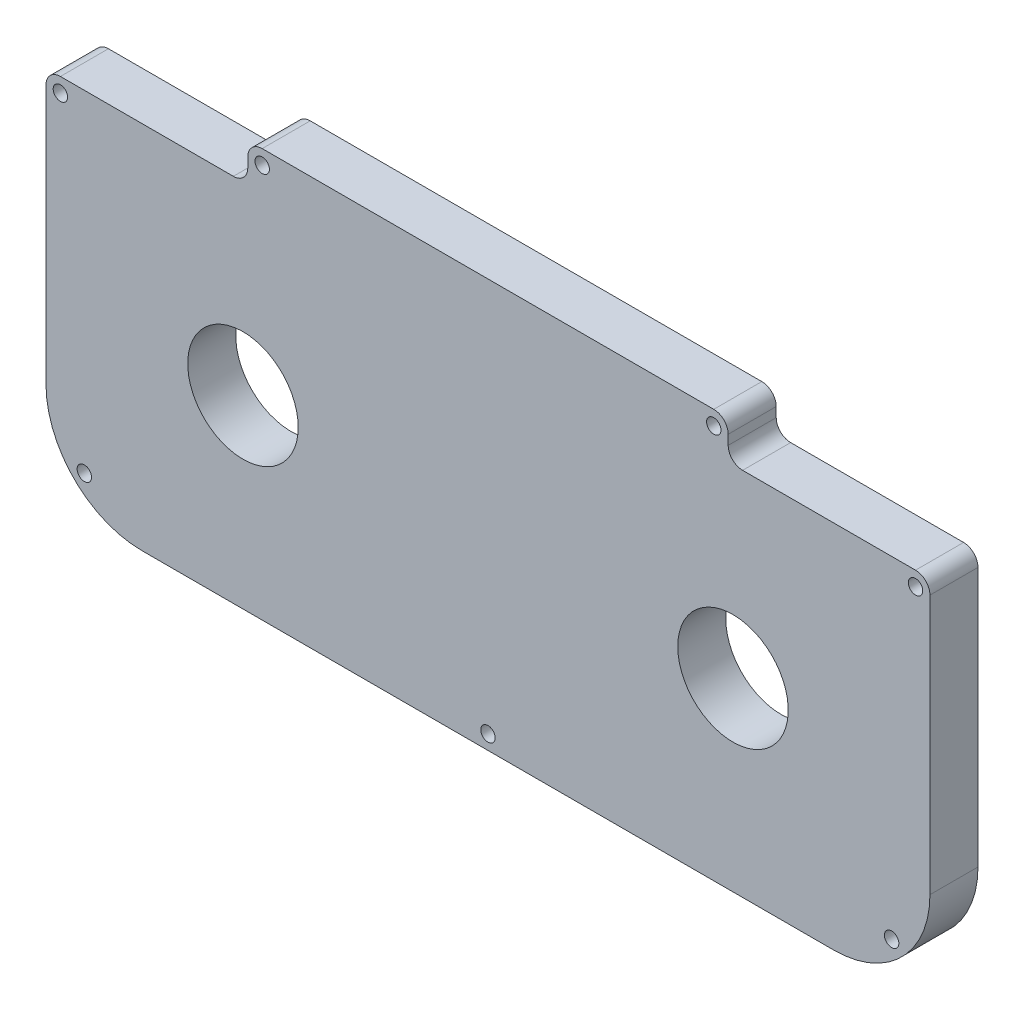
from build123d import *

# Parameters (mm, degrees)
SKETCH1_R           = 11.5
SKETCH1_R_2         = 1.5
BOSS_EXTRUDE1_DEPTH = 10


with BuildPart() as part:
    # Sketch1 → Boss-Extrude1 (new body)
    with BuildSketch(Plane.XY):
        with BuildLine():
            Line((50, 39.5), (50, 37.5))
            ThreePointArc((50, 37.5), (50.878679656, 35.378679656), (53, 34.5))
            Line((53, 34.5), (89, 34.5))
            ThreePointArc((89, 34.5), (91.121320344, 33.621320344), (92, 31.5))
            Line((92, 31.5), (92, -22.5))
            ThreePointArc((92, -22.5), (86.142135624, -36.642135624), (72, -42.5))
            Line((72, -42.5), (-72, -42.5))
            ThreePointArc((-72, -42.5), (-86.142135624, -36.642135624), (-92, -22.5))
            Line((-92, -22.5), (-92, 31.5))
            ThreePointArc((-92, 31.5), (-91.121320344, 33.621320344), (-89, 34.5))
            Line((-89, 34.5), (-53, 34.5))
            ThreePointArc((-53, 34.5), (-50.878679656, 35.378679656), (-50, 37.5))
            Line((-50, 37.5), (-50, 39.5))
            ThreePointArc((-50, 39.5), (-49.121320344, 41.621320344), (-47, 42.5))
            Line((-47, 42.5), (47, 42.5))
            ThreePointArc((47, 42.5), (49.121320344, 41.621320344), (50, 39.5))
        make_face()
        with Locations(Location((51, -4, 0), (0, 0, 180))):
            Circle(SKETCH1_R, mode=Mode.SUBTRACT)
        with Locations((0, -39.5)):
            Circle(SKETCH1_R_2, mode=Mode.SUBTRACT)
        with Locations((84.02081528, -34.52081528)):
            Circle(SKETCH1_R_2, mode=Mode.SUBTRACT)
        with Locations((89, 31.5)):
            Circle(SKETCH1_R_2, mode=Mode.SUBTRACT)
        with Locations((47, 39.5)):
            Circle(SKETCH1_R_2, mode=Mode.SUBTRACT)
        with Locations((-47, 39.5)):
            Circle(SKETCH1_R_2, mode=Mode.SUBTRACT)
        with Locations((-89, 31.5)):
            Circle(SKETCH1_R_2, mode=Mode.SUBTRACT)
        with Locations((-84.02081528, -34.52081528)):
            Circle(SKETCH1_R_2, mode=Mode.SUBTRACT)
        with Locations((-51, -4)):
            Circle(SKETCH1_R, mode=Mode.SUBTRACT)
    extrude(amount=BOSS_EXTRUDE1_DEPTH)


solid = part.part
